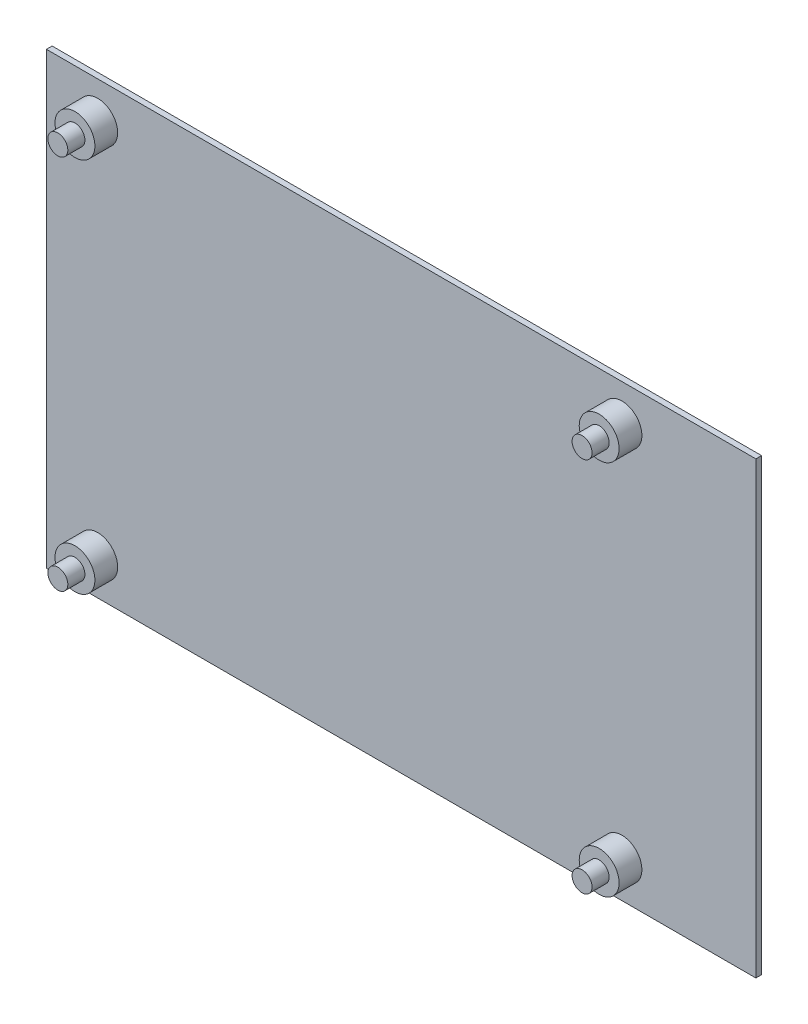
from build123d import *

# Parameters (mm, degrees)
SKETCH1_W           = 124.5
SKETCH1_H           = 78.9
BOSS_EXTRUDE1_DEPTH = 1
SKETCH2_R           = 3.5
BOSS_EXTRUDE2_DEPTH = 4
SKETCH3_R           = 1.75
BOSS_EXTRUDE3_DEPTH = 3


with BuildPart() as part:
    # Sketch1 → Boss-Extrude1 (new body)
    with BuildSketch(Plane.XY):
        with Locations((-15, -5.25)):
            Rectangle(SKETCH1_W, SKETCH1_H)
    extrude(amount=BOSS_EXTRUDE1_DEPTH)

    # Sketch2 → Boss-Extrude2 (add)
    with BuildSketch(Plane.XY.offset(1)):
        with Locations(Location((-68.25, 27.75, 0), (0, 0, 180))):
            Circle(SKETCH2_R)
        with Locations(Location((23.75, 27.75, 0), (0, 0, 180))):
            Circle(SKETCH2_R)
        with Locations(Location((23.75, -38.25, 0), (0, 0, 180))):
            Circle(SKETCH2_R)
        with Locations(Location((-68.25, -38.25, 0), (0, 0, 180))):
            Circle(SKETCH2_R)
    extrude(amount=BOSS_EXTRUDE2_DEPTH)

    # Sketch3 → Boss-Extrude3 (add)
    with BuildSketch(Plane.XY.offset(5)):
        with Locations((-68.25, 27.75)):
            Circle(SKETCH3_R)
        with Locations((23.75, 27.75)):
            Circle(SKETCH3_R)
        with Locations((23.75, -38.25)):
            Circle(SKETCH3_R)
        with Locations((-68.25, -38.25)):
            Circle(SKETCH3_R)
    extrude(amount=BOSS_EXTRUDE3_DEPTH)


solid = part.part
